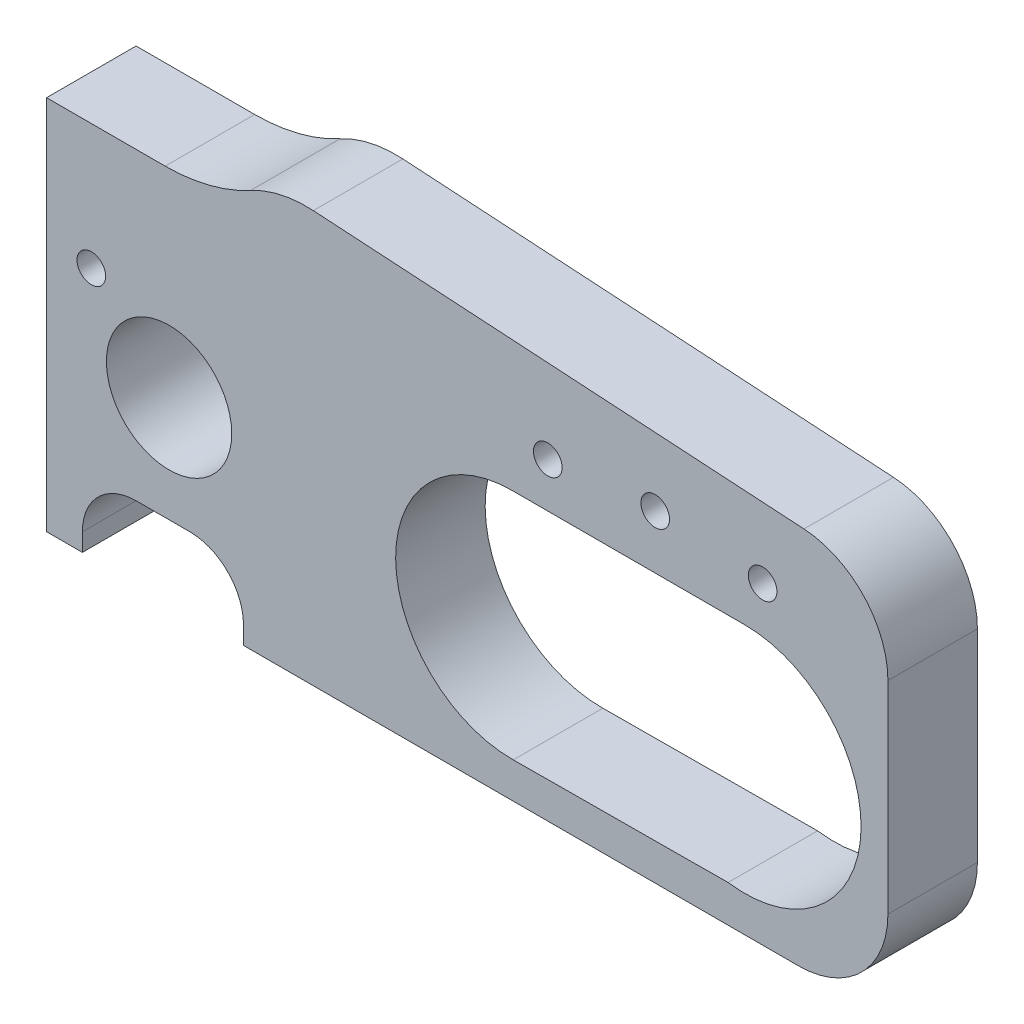
from build123d import *

# Parameters (mm, degrees)
SKETCH1_R           = 0.8
SKETCH1_R_2         = 3.5
SKETCH1_R_3         = 5.1
BOSS_EXTRUDE1_DEPTH = 5
SKETCH2_R           = 1.25
CUT_EXTRUDE1_DEPTH  = 5
BOSS_EXTRUDE2_START = -1
SKETCH21_R          = 5.1
BOSS_EXTRUDE2_DEPTH = 1
SKETCH22_W          = 9
SKETCH22_H          = 4
CUT_EXTRUDE2_DEPTH  = 10
FILLET1_R           = 3


with BuildPart() as part:
    # Sketch1 → Boss-Extrude1 (new body)
    with BuildSketch(Plane(origin=(0, 0, 0), x_dir=(0, 1, 0), z_dir=(0, 0, 1))):
        with BuildLine():
            ThreePointArc((7.923715338, -23.061842121), (11.348253353, -21.704991773), (12.914157128, -18.370857874))
            Line((12.914157128, -18.370857874), (14.611258571, 9.036437401))
            ThreePointArc((14.611258571, 9.036437401), (14.470096631, 10.842810788), (13.835805455, 12.540039768))
            ThreePointArc((13.835805455, 12.540039768), (12.931450551, 14.850335933), (12.623684243, 17.312165753))
            Line((12.623684243, 17.312165753), (12.623684243, 23.938157879))
            Line((12.623684243, 23.938157879), (-8.376315757, 23.938157879))
            Line((-8.376315757, 23.938157879), (-8.376315757, -18.061842121))
            ThreePointArc((-8.376315757, -18.061842121), (-6.911849663, -21.597376027), (-3.376315757, -23.061842121))
            Line((-3.376315757, -23.061842121), (7.923715338, -23.061842121))
        make_face()
        with BuildLine():
            Line((-6.37591859, -2.133696229), (-6.376315757, -2.061842121))
            ThreePointArc((-6.376315757, -2.061842121), (0.123684243, 4.438157879), (6.623684243, -2.061842121))
            Line((6.623684243, -2.061842121), (6.623684243, -15.061842121))
            ThreePointArc((6.623684243, -15.061842121), (0.625179068, -21.542467318), (-6.298932046, -16.061842121))
            ThreePointArc((-6.298932046, -16.061842121), (-6.376216465, -15.097769724), (-6.309594086, -14.132901895))
            Line((-6.309594086, -14.132901895), (-6.37591859, -2.133696229))
        make_face(mode=Mode.SUBTRACT)
        with Locations(Location((9.123684243, -16.061842121, 0), (0, 0, 270))):
            Circle(SKETCH1_R, mode=Mode.SUBTRACT)
        with Locations(Location((9.623684243, -10.061842121, 0), (0, 0, 270))):
            Circle(SKETCH1_R, mode=Mode.SUBTRACT)
        with Locations(Location((9.123684243, -4.061842121, 0), (0, 0, 270))):
            Circle(SKETCH1_R, mode=Mode.SUBTRACT)
        with Locations(Location((1.537022692, 17.094912388, 0), (0, 0, 270))):
            Circle(SKETCH1_R_2, mode=Mode.SUBTRACT)
        with Locations(Location((8.123684243, 9.438157879, 0), (0, 0, 270))):
            Circle(SKETCH1_R_3, mode=Mode.SUBTRACT)
        with Locations(Location((5.623684243, 21.438157879, 0), (0, 0, 270))):
            Circle(SKETCH1_R, mode=Mode.SUBTRACT)
    extrude(amount=BOSS_EXTRUDE1_DEPTH)

    # Sketch2 → Cut-Extrude1 (cut)
    with BuildSketch(Plane(origin=(-23.938157879, 0, 0), x_dir=(0, -1, 0), z_dir=(-1, 0, 0))):
        with Locations(Location((-9.623684243, 2.5, 0), (0, 0, 90))):
            Circle(SKETCH2_R)
        with Locations(Location((2.876315757, 2.5, 0), (0, 0, 90))):
            Circle(SKETCH2_R)
    extrude(amount=-CUT_EXTRUDE1_DEPTH, mode=Mode.SUBTRACT)

    # Sketch21 → Boss-Extrude2 (add)
    with BuildSketch(Plane.XY.offset(5).offset(BOSS_EXTRUDE2_START)):
        with Locations((-9.438157879, 8.123684243)):
            Circle(SKETCH21_R)
    extrude(amount=BOSS_EXTRUDE2_DEPTH)

    # Sketch22 → Cut-Extrude2 (cut)
    with BuildSketch(Plane(origin=(0, 0, 0), x_dir=(1, 0, 0), z_dir=(0, 0, -1))):
        with Locations((-17.438157879, 6.376315757)):
            Rectangle(SKETCH22_W, SKETCH22_H)
    extrude(amount=-CUT_EXTRUDE2_DEPTH, mode=Mode.SUBTRACT)

    # Fillet1
    fillet1_edges = [part.edges().sort_by_distance(p)[0] for p in [
        (-12.938157879, -4.376315757, 2.5),
        (-21.938157879, -4.376315757, 2.5),
    ]]
    fillet(fillet1_edges, radius=FILLET1_R)


solid = part.part
